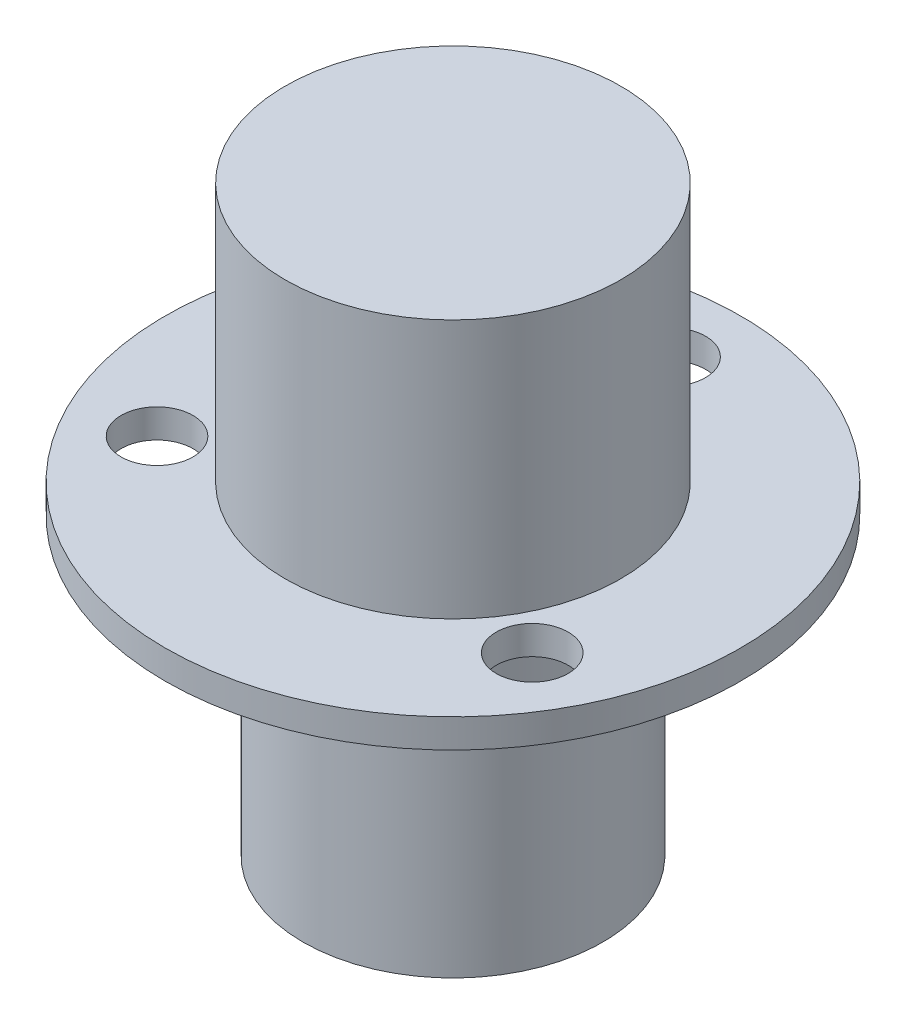
from build123d import *

# Parameters (mm, degrees)
SKETCH1_R           = 12
SKETCH1_R_2         = 2.5
BOSS_EXTRUDE1_DEPTH = 1.2
SKETCH2_R           = 1.5
CUT_EXTRUDE1_DEPTH  = 1.2
SKETCH3_R           = 6.25
BOSS_EXTRUDE2_DEPTH = 12.3
SKETCH4_R           = 7
BOSS_EXTRUDE3_DEPTH = 12


with BuildPart() as part:
    # Sketch1 → Boss-Extrude1 (new body)
    with BuildSketch(Plane(origin=(0, 0, 0), x_dir=(1, 0, 0), z_dir=(0, 1, 0))):
        with Locations(Location((0, 0, 0), (0, 0, 270))):
            Circle(SKETCH1_R)
        with Locations(Location((0, 0, 0), (0, 0, 270))):
            Circle(SKETCH1_R_2, mode=Mode.SUBTRACT)
    extrude(amount=BOSS_EXTRUDE1_DEPTH)

    # Sketch2 → Cut-Extrude1 (cut)
    with BuildSketch(Plane(origin=(0, 1.2, 0), x_dir=(1, 0, 0), z_dir=(0, 1, 0))):
        with Locations(Location((0, 9.034469011, 0), (0, 0, 270))):
            Circle(SKETCH2_R)
        with Locations(Location((7.824079673, -4.517234506, 0), (0, 0, 270))):
            Circle(SKETCH2_R)
        with Locations(Location((-7.824079673, -4.517234506, 0), (0, 0, 270))):
            Circle(SKETCH2_R)
    extrude(amount=-CUT_EXTRUDE1_DEPTH, mode=Mode.SUBTRACT)

    # Sketch3 → Boss-Extrude2 (add)
    with BuildSketch(Plane(origin=(0, 0, 0), x_dir=(-1, 0, 0), z_dir=(0, -1, 0))):
        with Locations(Location((0, 0, 0), (0, 0, 270))):
            Circle(SKETCH3_R)
    extrude(amount=BOSS_EXTRUDE2_DEPTH)

    # Sketch4 → Boss-Extrude3 (add)
    with BuildSketch(Plane(origin=(0, 0, 0), x_dir=(1, 0, 0), z_dir=(0, 1, 0))):
        with Locations(Location((0, 0, 0), (0, 0, 270))):
            Circle(SKETCH4_R)
    extrude(amount=BOSS_EXTRUDE3_DEPTH)


solid = part.part
